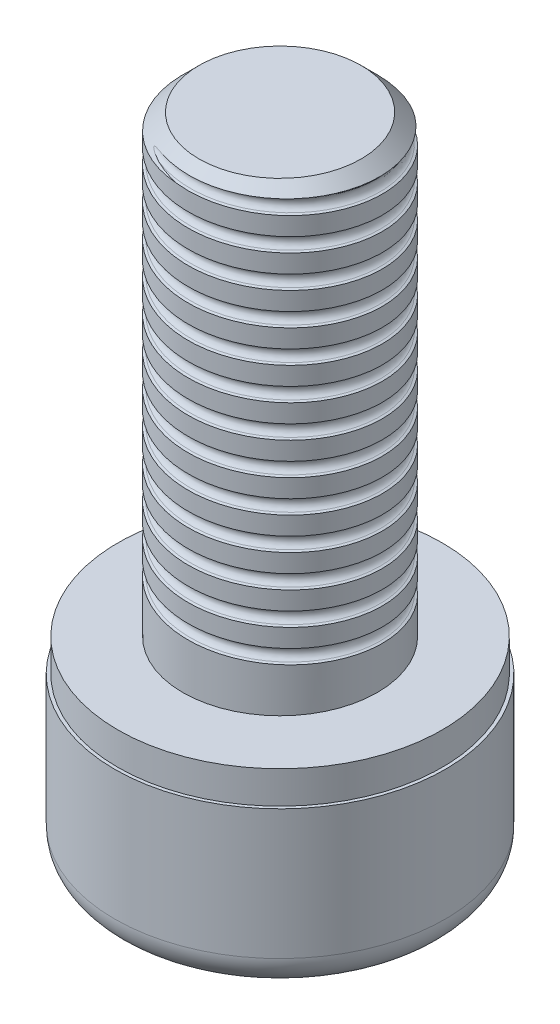
from build123d import *

# Parameters (mm, degrees)
SKETCH_1_R          = 5.1
EXTRUDE_1_DEPTH     = 6
SKETCH_2_R          = 3
EXTRUDE_2_DEPTH     = 14
CHAMFER_1_SIZE      = 0.5
CUT_EXTRUDE_1_DEPTH = 2.5
FILLET_1_R          = 1
SWEEP_1_PITCH       = 1
SWEEP_1_HEIGHT      = 12.75
SWEEP_1_RADIUS      = 3
SWEEP_1_START_ANGLE = -150
CUT_EXTRUDE_START   = -1
SKETCH_4_R          = 5.1
SKETCH_4_R_2        = 5
CUT_EXTRUDE_2_DEPTH = 1


with BuildPart() as part:
    # Эскиз1 → Бобышка-Вытянуть1 (new body)
    with BuildSketch(Plane(origin=(0, 0, 0), x_dir=(1, 0, 0), z_dir=(0, 1, 0))):
        with Locations(Location((0, 0, 0), (0, 0, 270))):
            Circle(SKETCH_1_R)
    extrude(amount=EXTRUDE_1_DEPTH)

    # Эскиз2 → Бобышка-Вытянуть2 (add)
    with BuildSketch(Plane(origin=(0, 6, 0), x_dir=(1, 0, 0), z_dir=(0, 1, 0))):
        with Locations(Location((0, 0, 0), (0, 0, 270))):
            Circle(SKETCH_2_R)
    extrude(amount=EXTRUDE_2_DEPTH)

    # Фаска1
    chamfer_1_edges = [part.edges().sort_by_distance(p)[0] for p in [
        (0, 20, -3),
    ]]
    chamfer(chamfer_1_edges, length=CHAMFER_1_SIZE)

    # Эскиз3 → Вырез-Вытянуть1 (cut)
    with BuildSketch(Plane.XZ):
        Polygon((2.536280165, -1.495754969), (2.563501883, 1.448605569), (0.027221719, 2.944360538), (-2.536280165, 1.495754969), (-2.563501883, -1.448605569), (-0.027221719, -2.944360538), align=None)
    extrude(amount=-CUT_EXTRUDE_1_DEPTH, mode=Mode.SUBTRACT)

    # Скругление1
    fillet_1_edges = [part.edges().sort_by_distance(p)[0] for p in [
        (0, 0, -5.1),
    ]]
    fillet(fillet_1_edges, radius=FILLET_1_R)

    # Вырез-По траектории1: sweep along a helix
    with BuildLine() as sweep_1_path:
        add(Helix(SWEEP_1_PITCH, SWEEP_1_HEIGHT, SWEEP_1_RADIUS, center=(0, 19.5, 0), direction=(0, -1, 0), lefthand=True, mode=Mode.PRIVATE).rotate(Axis((0, 19.5, 0), (0, -1, 0)), SWEEP_1_START_ANGLE))
    # Эскиз10 → Вырез-По траектории1 (sweep, cut)
    with BuildSketch(Plane.XY):
        with BuildLine():
            Line((3.4, 16.822824197), (3.4, 16.094883729))
            Line((3.4, 16.094883729), (2.929813333, 16.26601768))
            ThreePointArc((2.929813333, 16.26601768), (2.794787914, 16.458853963), (2.929813333, 16.651690246))
            Line((2.929813333, 16.651690246), (3.4, 16.822824197))
        make_face()
    sweep(path=sweep_1_path.line, is_frenet=True, mode=Mode.SUBTRACT)

    # Эскиз4 → Вырез-Вытянуть2 (cut)
    with BuildSketch(Plane(origin=(0, 6, 0), x_dir=(1, 0, 0), z_dir=(0, 1, 0)).offset(CUT_EXTRUDE_START)):
        with Locations(Location((0, 0, 0), (0, 0, 270))):
            Circle(SKETCH_4_R)
        with Locations(Location((0, 0, 0), (0, 0, 270))):
            Circle(SKETCH_4_R_2, mode=Mode.SUBTRACT)
    extrude(amount=CUT_EXTRUDE_2_DEPTH, mode=Mode.SUBTRACT)


solid = part.part
